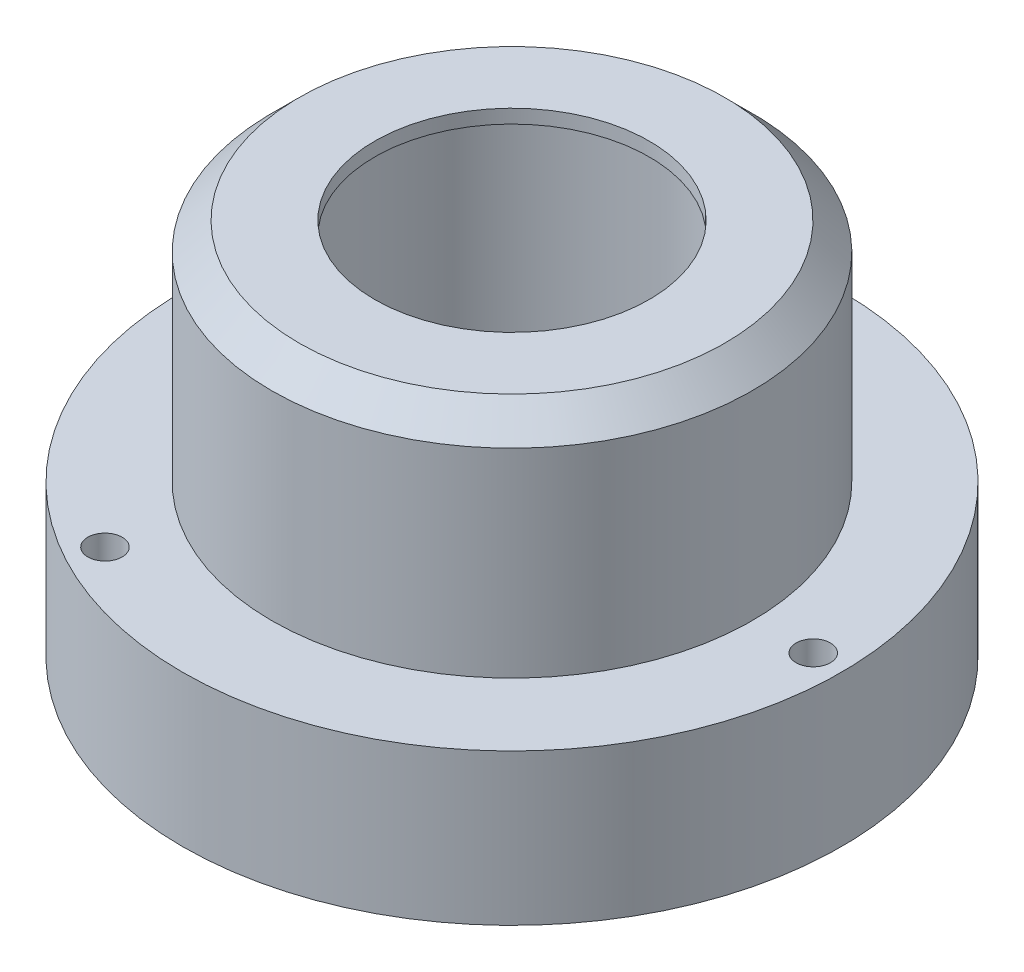
from build123d import *

# Parameters (mm, degrees)
R_P_TITION_CIRCULAIRE1_COUNT = 3


with BuildPart() as part:
    # Esquisse1 → Révolution1 (revolve)
    with BuildSketch(Plane.XY, mode=Mode.PRIVATE) as r_volution1_sk:
        Polygon((23.5, 0), (23.5, 53), (20, 53), (20, 55), (31, 55), (35, 51), (35, 22), (48, 22), (48, 0), align=None)
    revolve(r_volution1_sk.sketch.rotate(Axis((0, 45.247444815, 0), (0, -1, 0)), 90), axis=Axis((0, 45.247444815, 0), (0, -1, 0)))

    # Esquisse2 → Trou taraudé M61 (revolve, cut)
    with BuildSketch(Plane(origin=(43.498358535, 22, -0.377895148), x_dir=(0, 0, 1), z_dir=(1, 0, 0))):
        Polygon((0, 0), (0, 18.443375673), (2.5, 17), (2.5, 0), align=None)
    trou_taraud_m61 = revolve(axis=Axis((43.498358535, 28.35, -0.377895148), (0, -1, 0)), mode=Mode.SUBTRACT)

    # Esquisse3 → Trou taraudé M41 (revolve, cut)
    with BuildSketch(Plane(origin=(28, 0, 0), x_dir=(0, 0, -1), z_dir=(1, 0, 0))):
        Polygon((0, 0), (0, 12.452627944), (1.65, 11.5), (1.65, 0), align=None)
    trou_taraud_m41 = revolve(axis=Axis((28, -6.35, 0), (0, 1, 0)), mode=Mode.SUBTRACT)

    # Esquisse4 → Trou taraudé M62 (revolve, cut)
    with BuildSketch(Plane(origin=(-43, 0, 0), x_dir=(0, 0, -1), z_dir=(1, 0, 0))):
        Polygon((0, 0), (0, 18.443375673), (2.5, 17), (2.5, 0), align=None)
    trou_taraud_m62 = revolve(axis=Axis((-43, -6.35, 0), (0, 1, 0)), mode=Mode.SUBTRACT)

    # Répétition circulaire1: Trou taraudé M61, Trou taraudé M41, Trou taraudé M62 ×3 about axis
    r_p_tition_circulaire1_axis = Axis((0, 0, 0), (0, 1, 0))
    add([trou_taraud_m61.rotate(r_p_tition_circulaire1_axis, i * 360 / R_P_TITION_CIRCULAIRE1_COUNT) for i in range(1, R_P_TITION_CIRCULAIRE1_COUNT)], mode=Mode.SUBTRACT)
    add([trou_taraud_m41.rotate(r_p_tition_circulaire1_axis, i * 360 / R_P_TITION_CIRCULAIRE1_COUNT) for i in range(1, R_P_TITION_CIRCULAIRE1_COUNT)], mode=Mode.SUBTRACT)
    add([trou_taraud_m62.rotate(r_p_tition_circulaire1_axis, i * 360 / R_P_TITION_CIRCULAIRE1_COUNT) for i in range(1, R_P_TITION_CIRCULAIRE1_COUNT)], mode=Mode.SUBTRACT)


solid = part.part
